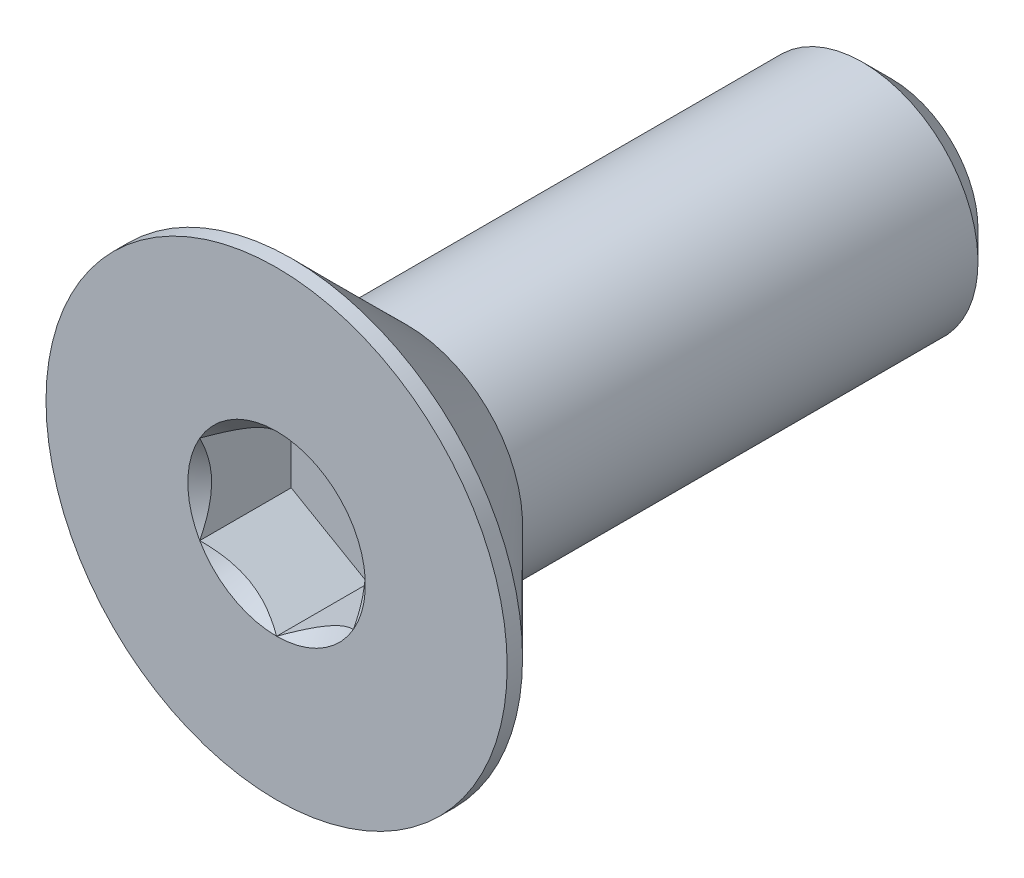
from build123d import *

# Parameters (mm, degrees)
SKETCH1_W          = 8
SKETCH1_H          = 1.5
CHAMFER1_SIZE      = 0.375
CUT_EXTRUDE2_DEPTH = 1.19


with BuildPart() as part:
    # Sketch1 → Revolve1 (revolve)
    with BuildSketch(Plane(origin=(0, 0, 0), x_dir=(0, 0, -1), z_dir=(1, 0, 0))):
        with Locations((4, 0.75)):
            Rectangle(SKETCH1_W, SKETCH1_H)
    revolve(axis=Axis((0, 0, -8), (0, 0, 1)))

    # Chamfer1
    chamfer1_edges = [part.edges().sort_by_distance(p)[0] for p in [
        (0, -1.5, -8),
    ]]
    chamfer(chamfer1_edges, length=CHAMFER1_SIZE)

    # Sketch7 → Revolve2 (revolve)
    with BuildSketch(Plane(origin=(0, 0, 0), x_dir=(0, 0, -1), z_dir=(1, 0, 0)), mode=Mode.PRIVATE) as revolve2_sk:
        Polygon((0, 3), (0.2, 3), (1.7, 1.5), (1.7, 0), (0, 0), align=None)
    revolve(revolve2_sk.sketch.rotate(Axis((0, 0, 0), (0, 0, -1)), 180), axis=Axis((0, 0, 0), (0, 0, -1)))

    # Boss-Extrude1 cone 1 section (through the dimple's axis) → Boss-Extrude1 (revolve)
    with BuildSketch(Plane(origin=(0, 0, -1.7), x_dir=(0, -1, 0), z_dir=(1, 0, 0))):
        Polygon((0, 0), (1.5, 0), (0, 1.5), align=None)
    revolve(axis=Axis((0, 0, -1.7), (0, 0, -1)))

    # Sketch5 → Cut-Extrude2 (cut)
    with BuildSketch(Plane.XY):
        Polygon((1, -0.577350269), (1, 0.577350269), (0, 1.154700538), (-1, 0.577350269), (-1, -0.577350269), (0, -1.154700538), align=None)
    extrude(amount=-CUT_EXTRUDE2_DEPTH, mode=Mode.SUBTRACT)

    # Cut-Extrude3 cone 1 section (through the dimple's axis) → Cut-Extrude3 (revolve, cut)
    with BuildSketch(Plane(origin=(0, 0, 0), x_dir=(0, -1, 0), z_dir=(1, 0, 0))):
        Polygon((0, 0), (1.154700538, 0), (0, 1.154700538), align=None)
    revolve(axis=Axis((0, 0, 0), (0, 0, -1)), mode=Mode.SUBTRACT)


solid = part.part
